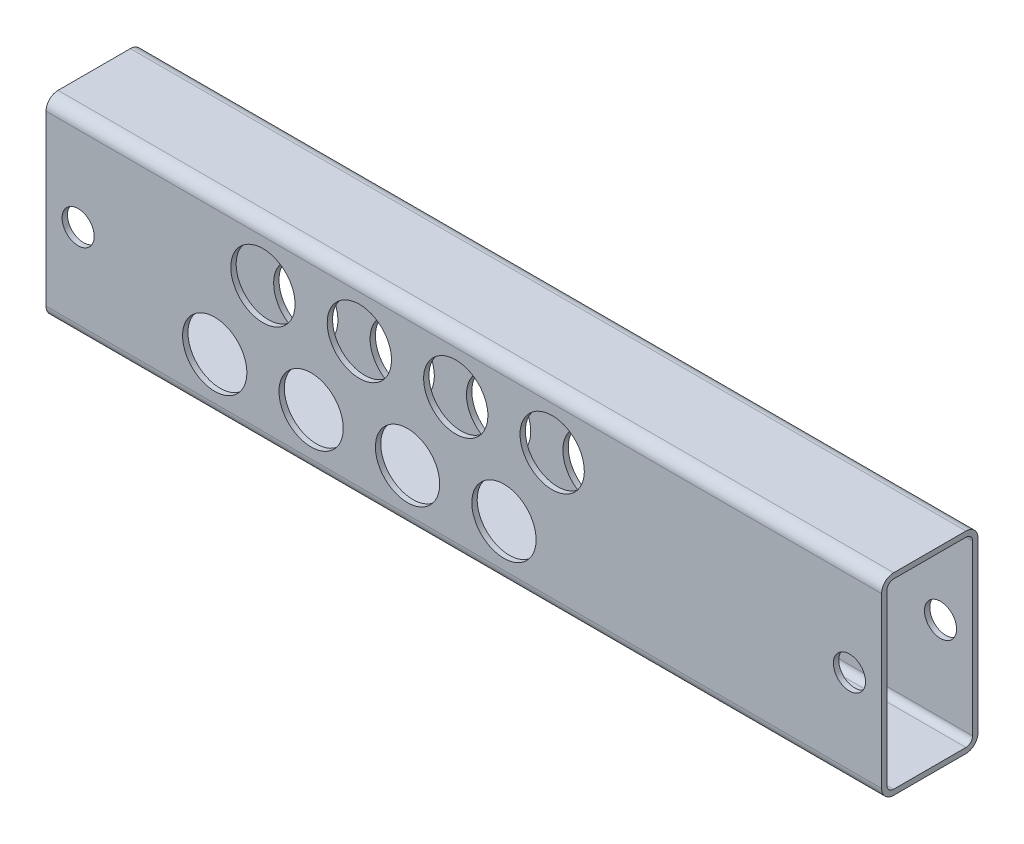
from build123d import *

# Parameters (mm, degrees)
STRUCTURAL_MEMBER1_DEPTH = 330.2
SKETCH15_R               = 6.35
CUT_EXTRUDE1_DEPTH       = 229.688177438
SKETCH16_R               = 12.7
CUT_EXTRUDE2_DEPTH       = 229.688177438
LPATTERN1_COUNT          = 4
LPATTERN1_PITCH          = 38.1


with BuildPart() as part:
    # Sketch13 → Structural Member1 (new body)
    with BuildSketch(Plane.ZY.offset(-107.95)):
        with BuildLine():
            Line((-14.2875, -38.1), (14.2875, -38.1))
            ThreePointArc((14.2875, -38.1), (17.655096045, -36.705096045), (19.05, -33.3375))
            Line((19.05, -33.3375), (19.05, 33.3375))
            ThreePointArc((19.05, 33.3375), (17.655096045, 36.705096045), (14.2875, 38.1))
            Line((14.2875, 38.1), (-14.2875, 38.1))
            ThreePointArc((-14.2875, 38.1), (-17.655096045, 36.705096045), (-19.05, 33.3375))
            Line((-19.05, 33.3375), (-19.05, -33.3375))
            ThreePointArc((-19.05, -33.3375), (-17.655096045, -36.705096045), (-14.2875, -38.1))
        make_face()
        with BuildLine():
            Line((-14.2875, -35.98418), (14.2875, -35.98418))
            ThreePointArc((14.2875, -35.98418), (16.158985376, -35.208985376), (16.93418, -33.3375))
            Line((16.93418, -33.3375), (16.93418, 33.3375))
            ThreePointArc((16.93418, 33.3375), (16.158985376, 35.208985376), (14.2875, 35.98418))
            Line((14.2875, 35.98418), (-14.2875, 35.98418))
            ThreePointArc((-14.2875, 35.98418), (-16.158985376, 35.208985376), (-16.93418, 33.3375))
            Line((-16.93418, 33.3375), (-16.93418, -33.3375))
            ThreePointArc((-16.93418, -33.3375), (-16.158985376, -35.208985376), (-14.2875, -35.98418))
        make_face(mode=Mode.SUBTRACT)
    extrude(amount=STRUCTURAL_MEMBER1_DEPTH)

    # Sketch15 → Cut-Extrude1 (cut, through all)
    with BuildSketch(Plane(origin=(0, 0, -19.05), x_dir=(-1, 0, 0), z_dir=(0, 0, -1))):
        with Locations(Location((-95.25, 0, 0), (0, 0, 90))):
            Circle(SKETCH15_R)
        with Locations(Location((209.55, 0, 0), (0, 0, 90))):
            Circle(SKETCH15_R)
    extrude(amount=-CUT_EXTRUDE1_DEPTH, mode=Mode.SUBTRACT)

    # Sketch16 → Cut-Extrude2 (cut, through all)
    with BuildSketch(Plane(origin=(0, 0, -19.05), x_dir=(-1, 0, 0), z_dir=(0, 0, -1))):
        with Locations(Location((22.225, 16.497783942, 0), (0, 0, 90))):
            Circle(SKETCH16_R)
        with Locations(Location((41.275, -16.497783942, 0), (0, 0, 90))):
            Circle(SKETCH16_R)
    cut_extrude2 = extrude(amount=-CUT_EXTRUDE2_DEPTH, mode=Mode.SUBTRACT)

    # LPattern1: Cut-Extrude2 ×4
    with Locations(*[(-i * LPATTERN1_PITCH, 0, 0) for i in range(1, LPATTERN1_COUNT)]):
        add(cut_extrude2, mode=Mode.SUBTRACT)


solid = part.part
